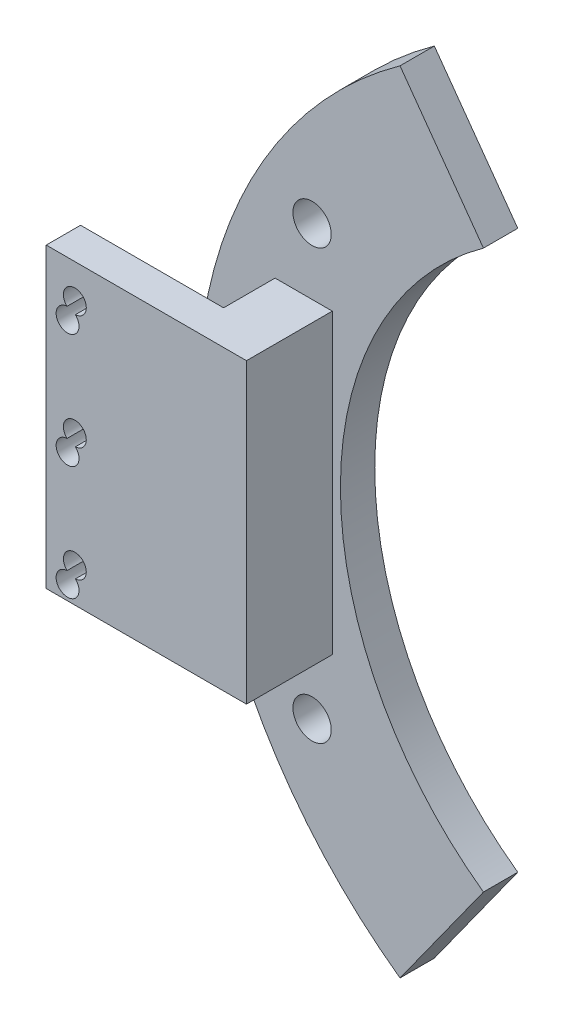
from build123d import *

# Parameters (mm, degrees)
SKETCH_1_R          = 85
SKETCH_1_R_2        = 60
EXTRUDE_1_DEPTH     = 6
SKETCH_2_R          = 3.35
CUT_EXTRUDE_1_DEPTH = 10
SKETCH_3_W          = 10
SKETCH_3_H          = 52
EXTRUDE_2_DEPTH     = 15
SKETCH_8_W          = 6
SKETCH_8_H          = 52
EXTRUDE_3_DEPTH     = 25
SKETCH_10_W         = 8.003334919
SKETCH_10_H         = 52
EXTRUDE_4_DEPTH     = 25
SKETCH_11_R         = 2
CUT_EXTRUDE_3_DEPTH = 25
CUT_EXTRUDE_4_DEPTH = 50
SKETCH_6_R          = 2
CUT_EXTRUDE_2_DEPTH = 20


with BuildPart() as part:
    # 草图1 → 凸台-拉伸1 (new body)
    with BuildSketch(Plane.XY):
        Circle(SKETCH_1_R)
        Circle(SKETCH_1_R_2, mode=Mode.SUBTRACT)
    extrude(amount=EXTRUDE_1_DEPTH)

    # 草图2 → 切除-拉伸1 (cut)
    with BuildSketch(Plane.XY.offset(6)):
        with Locations((0, 75)):
            Circle(SKETCH_2_R)
        with Locations((64.951905284, 37.5)):
            Circle(SKETCH_2_R)
        with Locations((64.951905284, -37.5)):
            Circle(SKETCH_2_R)
        with Locations((0, -75)):
            Circle(SKETCH_2_R)
        with Locations((-64.951905284, -37.5)):
            Circle(SKETCH_2_R)
        with Locations((-64.951905284, 37.5)):
            Circle(SKETCH_2_R)
    extrude(amount=-CUT_EXTRUDE_1_DEPTH, mode=Mode.SUBTRACT)

    # 草图3 → 凸台-拉伸2 (add)
    with BuildSketch(Plane.XY.offset(6)):
        with Locations((66.419532829, -0.009729533)):
            Rectangle(SKETCH_3_W, SKETCH_3_H)
        with Locations((-66.419532829, -0.009729533)):
            Rectangle(SKETCH_3_W, SKETCH_3_H)
    extrude(amount=EXTRUDE_2_DEPTH)

    # 草图8 → 凸台-拉伸3 (add)
    with BuildSketch(Plane.ZY.offset(71.419532829)):
        with Locations((18, -0.009729533)):
            Rectangle(SKETCH_8_W, SKETCH_8_H)
    extrude(amount=EXTRUDE_3_DEPTH)

    # 草图10 → 凸台-拉伸4 (add)
    with BuildSketch(Plane(origin=(71.419532829, 0, 0), x_dir=(0, 0, -1), z_dir=(1, 0, 0))):
        with Locations((-16.998332541, -0.009729533)):
            Rectangle(SKETCH_10_W, SKETCH_10_H)
    extrude(amount=EXTRUDE_4_DEPTH)

    # 草图11 → 切除-拉伸3 (cut)
    with BuildSketch(Plane.XY.offset(21)):
        with Locations((-91.419532829, 0)):
            Circle(SKETCH_11_R)
        with Locations((-91.419532829, 20)):
            Circle(SKETCH_11_R)
        with Locations(Location((91.419532829, 0, 0), (0, 0, 270))):
            Circle(SKETCH_11_R)
        with Locations(Location((91.419532829, 20, 0), (0, 0, 270))):
            Circle(SKETCH_11_R)
        with Locations((91.419532829, -20)):
            Circle(SKETCH_11_R)
        with Locations(Location((-91.419532829, -20, 0), (0, 0, 270))):
            Circle(SKETCH_11_R)
    extrude(amount=-CUT_EXTRUDE_3_DEPTH, mode=Mode.SUBTRACT)

    # 草图12 → 切除-拉伸4 (cut, symmetric)
    with BuildSketch(Plane.XY.offset(6)):
        with BuildLine():
            Line((-35, 48.733971724), (-49.583333333, 69.039793276))
            ThreePointArc((-49.583333333, 69.039793276), (-42.500689847, 73.611761034), (-35, 77.459666924))
            Line((-35, 77.459666924), (-35, 90))
            Line((-35, 90), (35, 90))
            Line((35, 90), (153.524849436, 90))
            Line((153.524849436, 90), (153.524849436, -90))
            Line((153.524849436, -90), (35, -90))
            Line((35, -90), (-35, -90))
            Line((-35, -90), (-35, -77.459666924))
            ThreePointArc((-35, -77.459666924), (-42.500689847, -73.611761034), (-49.583333333, -69.039793276))
            Line((-49.583333333, -69.039793276), (-35, -48.733971724))
            Line((-35, -48.733971724), (-35, 48.733971724))
        make_face()
    extrude(amount=CUT_EXTRUDE_4_DEPTH, both=True, mode=Mode.SUBTRACT)

    # 草图6 → 切除-拉伸2 (cut)
    with BuildSketch(Plane.XY.offset(26)):
        with Locations((92.689735177, -3.459773101)):
            Circle(SKETCH_6_R)
        with Locations((92.689735177, -23.459773101)):
            Circle(SKETCH_6_R)
        with Locations((92.689735177, 16.540226899)):
            Circle(SKETCH_6_R)
        with Locations((-92.689735177, -23.459773101)):
            Circle(SKETCH_6_R)
        with Locations((-92.689735177, -3.459773101)):
            Circle(SKETCH_6_R)
        with Locations((-92.689735177, 16.540226899)):
            Circle(SKETCH_6_R)
    extrude(amount=-CUT_EXTRUDE_2_DEPTH, mode=Mode.SUBTRACT)


solid = part.part
